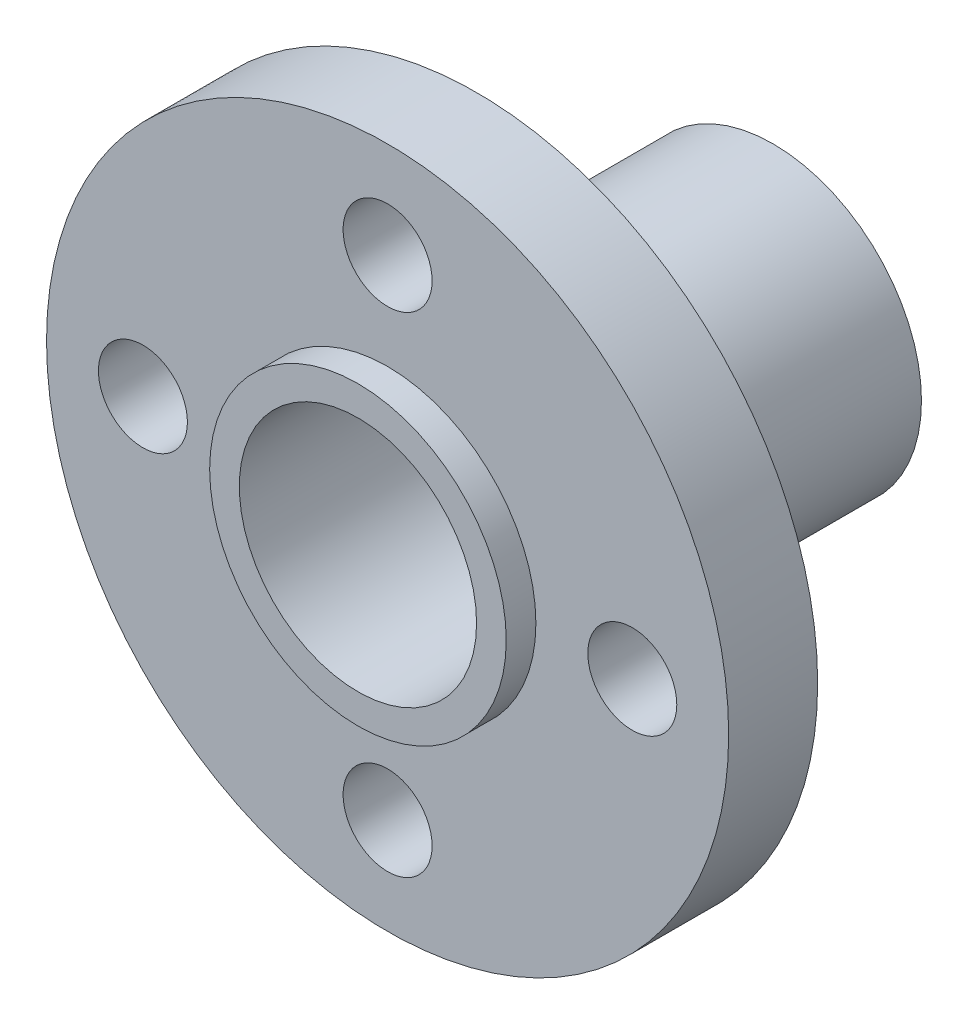
from build123d import *

# Parameters (mm, degrees)
SKETCH1_R                = 11.5
BOSS_EXTRUDE1_DEPTH      = 3
BOSS_EXTRUDE2_DEPTH      = 1
BOSS_EXTRUDE2_DEPTH_BACK = 13
SKETCH2_R                = 5
SKETCH2_R_2              = 4
SKETCH3_R                = 4
CUT_EXTRUDE1_DEPTH       = 5
SKETCH4_R                = 1.5
CUT_EXTRUDE2_DEPTH       = 5


with BuildPart() as part:
    # Sketch1 → Boss-Extrude1 (new body)
    with BuildSketch(Plane.XY):
        Circle(SKETCH1_R)
    extrude(amount=BOSS_EXTRUDE1_DEPTH)

    # Sketch2 → Boss-Extrude2 (add, two sides: drawn at the far end of the back side and taken through both)
    with BuildSketch(Plane.XY.offset(3).offset(-BOSS_EXTRUDE2_DEPTH_BACK)):
        Circle(SKETCH2_R)
        Circle(SKETCH2_R_2, mode=Mode.SUBTRACT)
    extrude(amount=BOSS_EXTRUDE2_DEPTH + BOSS_EXTRUDE2_DEPTH_BACK)

    # Sketch3 → Cut-Extrude1 (cut)
    with BuildSketch(Plane.XY.offset(3)):
        Circle(SKETCH3_R)
    extrude(amount=-CUT_EXTRUDE1_DEPTH, mode=Mode.SUBTRACT)

    # Sketch4 → Cut-Extrude2 (cut)
    with BuildSketch(Plane.XY.offset(3)):
        with Locations((0, 8.25)):
            Circle(SKETCH4_R)
        with Locations((8.25, 0)):
            Circle(SKETCH4_R)
        with Locations((0, -8.25)):
            Circle(SKETCH4_R)
        with Locations((-8.25, 0)):
            Circle(SKETCH4_R)
    extrude(amount=-CUT_EXTRUDE2_DEPTH, mode=Mode.SUBTRACT)


solid = part.part
